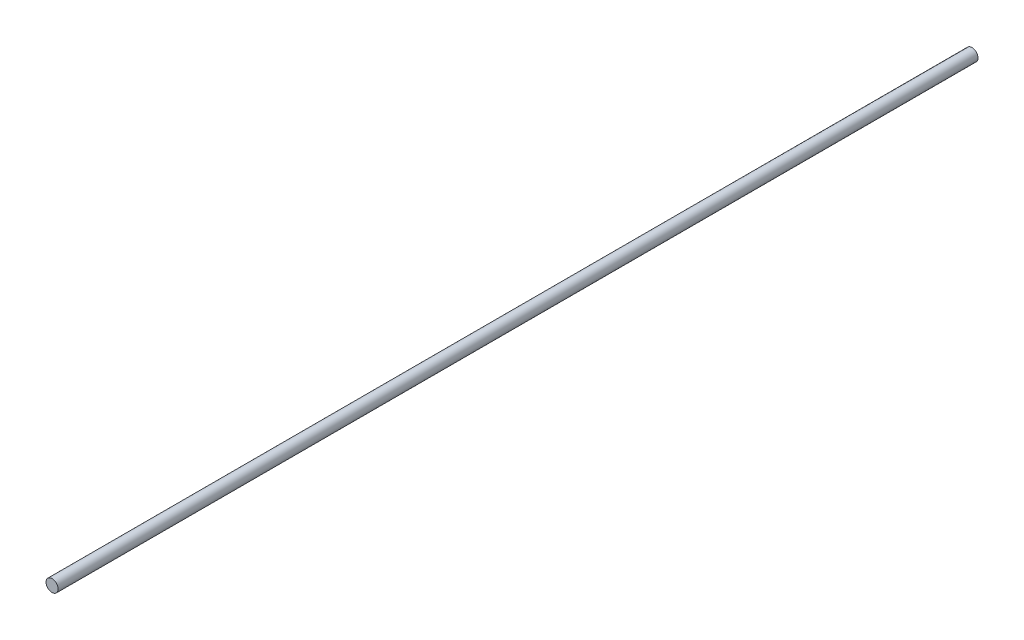
from build123d import *

# Parameters (mm, degrees)
SKETCH_1_R      = 0.75
EXTRUDE_1_DEPTH = 114


with BuildPart() as part:
    # 草图1 → 凸台-拉伸1 (new body)
    with BuildSketch(Plane.XY):
        with Locations(Location((0, 0, 0), (0, 0, 180))):
            Circle(SKETCH_1_R)
    extrude(amount=EXTRUDE_1_DEPTH)


solid = part.part
